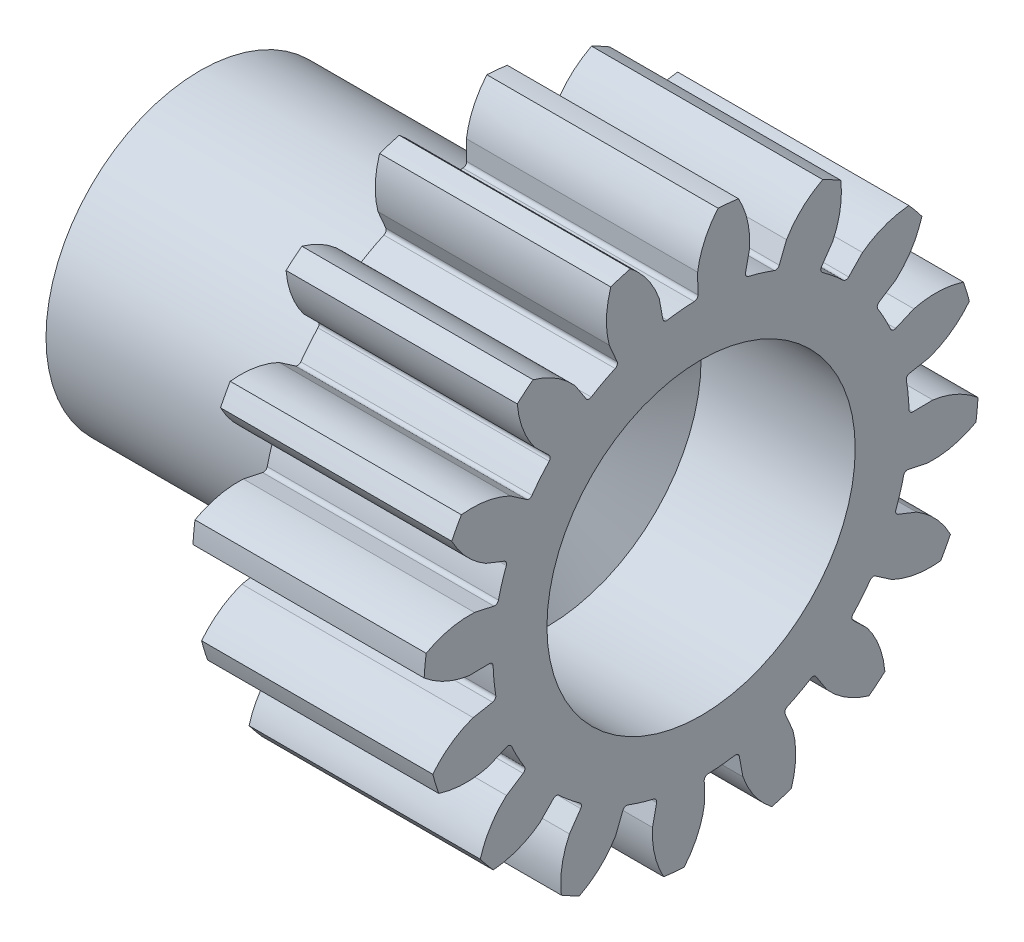
from build123d import *

# Parameters (mm, degrees)
SKETCH_2_R                       = 5.4
EXTRUDE_2_DEPTH                  = 6
SKETCH_5_R                       = 4
EXTRUDE_4_DEPTH                  = 7
HOLE_WIZARD_M51_D                = 4.2
HOLE_WIZARD_M51_DEPTH            = 14
HOLE_WIZARD_M51_CSINK_D          = 6.05
HOLE_WIZARD_M51_CSINK_ANGLE      = 90
HOLE_WIZARD_M51_TIP              = 1.2618073
EXTRUDE_5_REACH                  = 14.583
EXTRUDE_5_DIRECTION_2_REACH      = 14.583
FILLET_4_R                       = 0.1
PATTERN_CIRCULAR_1_COUNT         = 16
FILLET_4_OF_PATTERN_CIRCULAR_1_R = 0.1
FILLET_5_R                       = 0.2
HOLE_WIZARD_8_0_8_1_D            = 8
HOLE_WIZARD_8_0_8_1_DEPTH        = 4
HOLE_WIZARD_8_0_8_1_TIP          = 2.403442476


with BuildPart() as part:
    # Эскиз2 → Бобышка-Вытянуть2 (new body)
    with BuildSketch(Plane(origin=(0, 0, 0), x_dir=(0, 0, -1), z_dir=(1, 0, 0))):
        Circle(SKETCH_2_R)
    extrude(amount=EXTRUDE_2_DEPTH)

    # Эскиз5 → Бобышка-Вытянуть4 (add)
    with BuildSketch(Plane.ZY):
        Circle(SKETCH_5_R)
    extrude(amount=EXTRUDE_4_DEPTH)

    # Отверстие обработанное метчиком M51
    with Locations(Plane.ZY.offset(7)):
        with Locations((0, 0)):
            CounterSinkHole(HOLE_WIZARD_M51_D / 2, HOLE_WIZARD_M51_CSINK_D / 2, depth=HOLE_WIZARD_M51_DEPTH, counter_sink_angle=HOLE_WIZARD_M51_CSINK_ANGLE)
            with Locations((0, 0, -(HOLE_WIZARD_M51_DEPTH + HOLE_WIZARD_M51_TIP / 2))):  # 118° drill point
                Cone(0, HOLE_WIZARD_M51_D / 2, HOLE_WIZARD_M51_TIP, mode=Mode.SUBTRACT)

    # Бобышка-Вытянуть5: up to this face of the body (flat: up to its plane)
    extrude_5_end = Plane(part.part.faces().sort_by_distance((6, 0, 5.247264935))[0])
    # Эскиз9 → Бобышка-Вытянуть5 (add, up to the picked face)
    with BuildSketch(Plane(origin=(3, 0, 0), x_dir=(0, 0, -1), z_dir=(1, 0, 0)), mode=Mode.PRIVATE) as extrude_5_sk1:
        with BuildLine():
            Line((-0.089632134, 6.013364805), (-0.080480693, 5.399400231))
            ThreePointArc((-0.080480693, 5.399400231), (0.529292558, 5.373997524), (1.132305009, 5.279951266))
            Line((1.132305009, 5.279951266), (1.261059154, 5.880333324))
            add(Edge.make_bspline(
                [(1.261059154, 5.880333324), (1.295696363, 6.538751311), (0.970178552, 7.134336239)],
                knots=[0, 0, 0, 1, 1, 1], degree=2))
            ThreePointArc((0.970178552, 7.134336239), (0.70572341, 7.165330032), (0.440303111, 7.186524415))
            add(Edge.make_bspline(
                [(-0.089632134, 6.013364805), (0.004847178, 6.665888859), (0.440303111, 7.186524415)],
                knots=[0, 0, 0, 1, 1, 1], degree=2))
        make_face()
    extrude_5_tool1 = split(extrude(extrude_5_sk1.sketch, amount=EXTRUDE_5_REACH, mode=Mode.PRIVATE), bisect_by=extrude_5_end, keep=Keep.BOTH, mode=Mode.PRIVATE)
    extrude_5 = extrude_5_tool1.solids().sort_by(Axis((3, 6.178183, -0.608498), (1, 0, 0)))[0]
    add(extrude_5)

    # Бобышка-Вытянуть5 direction 2: up to this face of the body (flat: up to its plane)
    extrude_5_direction_2_end = Plane(part.part.faces().sort_by_distance((0, 0, 5.247264935))[0])
    # Эскиз9 → Бобышка-Вытянуть5 direction 2 (add, up to the picked face)
    with BuildSketch(Plane(origin=(3, 0, 0), x_dir=(0, 0, -1), z_dir=(1, 0, 0)), mode=Mode.PRIVATE) as extrude_5_direction_2_sk1:
        with BuildLine():
            Line((-0.089632134, 6.013364805), (-0.080480693, 5.399400231))
            ThreePointArc((-0.080480693, 5.399400231), (0.529292558, 5.373997524), (1.132305009, 5.279951266))
            Line((1.132305009, 5.279951266), (1.261059154, 5.880333324))
            add(Edge.make_bspline(
                [(1.261059154, 5.880333324), (1.295696363, 6.538751311), (0.970178552, 7.134336239)],
                knots=[0, 0, 0, 1, 1, 1], degree=2))
            ThreePointArc((0.970178552, 7.134336239), (0.70572341, 7.165330032), (0.440303111, 7.186524415))
            add(Edge.make_bspline(
                [(-0.089632134, 6.013364805), (0.004847178, 6.665888859), (0.440303111, 7.186524415)],
                knots=[0, 0, 0, 1, 1, 1], degree=2))
        make_face()
    extrude_5_direction_2_tool1 = split(extrude(extrude_5_direction_2_sk1.sketch, amount=-EXTRUDE_5_DIRECTION_2_REACH, mode=Mode.PRIVATE), bisect_by=extrude_5_direction_2_end, keep=Keep.BOTH, mode=Mode.PRIVATE)
    extrude_5_direction_2 = extrude_5_direction_2_tool1.solids().sort_by(Axis((3, 6.178183, -0.608498), (-1, 0, 0)))[0]
    add(extrude_5_direction_2)

    # Скругление4
    fillet_4_edges = [part.edges().sort_by_distance(p)[0] for p in [
        (3, 5.399400231, 0.080480693),
        (3, 5.279951266, -1.132305009),
    ]]
    fillet(fillet_4_edges, radius=FILLET_4_R)

    # Круговой массив1: Бобышка-Вытянуть5, Бобышка-Вытянуть5 direction 2 ×16 about axis
    pattern_circular_1_axis = Axis((6, 0, 0), (-1, 0, 0))
    add([extrude_5.rotate(pattern_circular_1_axis, i * 360 / PATTERN_CIRCULAR_1_COUNT) for i in range(1, PATTERN_CIRCULAR_1_COUNT)])
    add([extrude_5_direction_2.rotate(pattern_circular_1_axis, i * 360 / PATTERN_CIRCULAR_1_COUNT) for i in range(1, PATTERN_CIRCULAR_1_COUNT)])

    # Скругление4 of Круговой массив1
    fillet_4_of_pattern_circular_1_edges = [part.edges().sort_by_distance(p)[0] for p in [
        (3, 5.019193989, -1.991906548),
        (3, 4.44472454, -3.066663295),
        (3, 3.874860962, -3.761044074),
        (3, 2.932828794, -4.534149894),
        (3, 2.140615478, -4.957596734),
        (3, 0.974436451, -5.311353274),
        (3, 0.080480693, -5.399400231),
        (3, -1.132305009, -5.279951266),
        (3, -1.991906548, -5.019193989),
        (3, -3.066663295, -4.44472454),
        (3, -3.761044074, -3.874860962),
        (3, -4.534149894, -2.932828794),
        (3, -4.957596734, -2.140615478),
        (3, -5.311353274, -0.974436451),
        (3, -5.399400231, -0.080480693),
        (3, -5.279951266, 1.132305009),
        (3, -5.019193989, 1.991906548),
        (3, -4.44472454, 3.066663295),
        (3, -3.874860962, 3.761044074),
        (3, -2.932828794, 4.534149894),
        (3, -2.140615478, 4.957596734),
        (3, -0.974436451, 5.311353274),
        (3, -0.080480693, 5.399400231),
        (3, 1.132305009, 5.279951266),
        (3, 1.991906548, 5.019193989),
        (3, 3.066663295, 4.44472454),
        (3, 3.761044074, 3.874860962),
        (3, 4.534149894, 2.932828794),
        (3, 4.957596734, 2.140615478),
        (3, 5.311353274, 0.974436451),
    ]]
    fillet(fillet_4_of_pattern_circular_1_edges, radius=FILLET_4_OF_PATTERN_CIRCULAR_1_R)

    # Эскиз11 → Вырез-Повернуть3 (revolve, cut)
    with BuildSketch(Plane.XY, mode=Mode.PRIVATE) as cut_revolve_3_sk:
        Polygon((0, 4), (0, 3.7), (-0.5, 3.7), (-0.8, 4), align=None)
    revolve(cut_revolve_3_sk.sketch.rotate(Axis((-7, 0, 0), (1, 0, 0)), 90), axis=Axis((-7, 0, 0), (1, 0, 0)), mode=Mode.SUBTRACT)

    # Скругление5
    fillet_5_edges = [part.edges().sort_by_distance(p)[0] for p in [
        (0, 0, -3.7),
        (-0.5, 0, -3.7),
    ]]
    fillet(fillet_5_edges, radius=FILLET_5_R)

    # Диаметр отверстия Ø8.0 (8)1
    with Locations(Plane(origin=(6, 0, 0), x_dir=(0, 0, -1), z_dir=(1, 0, 0))):
        with Locations((0, 0)):
            Hole(HOLE_WIZARD_8_0_8_1_D / 2, depth=HOLE_WIZARD_8_0_8_1_DEPTH)
            with Locations((0, 0, -(HOLE_WIZARD_8_0_8_1_DEPTH + HOLE_WIZARD_8_0_8_1_TIP / 2))):  # 118° drill point
                Cone(0, HOLE_WIZARD_8_0_8_1_D / 2, HOLE_WIZARD_8_0_8_1_TIP, mode=Mode.SUBTRACT)


solid = part.part
